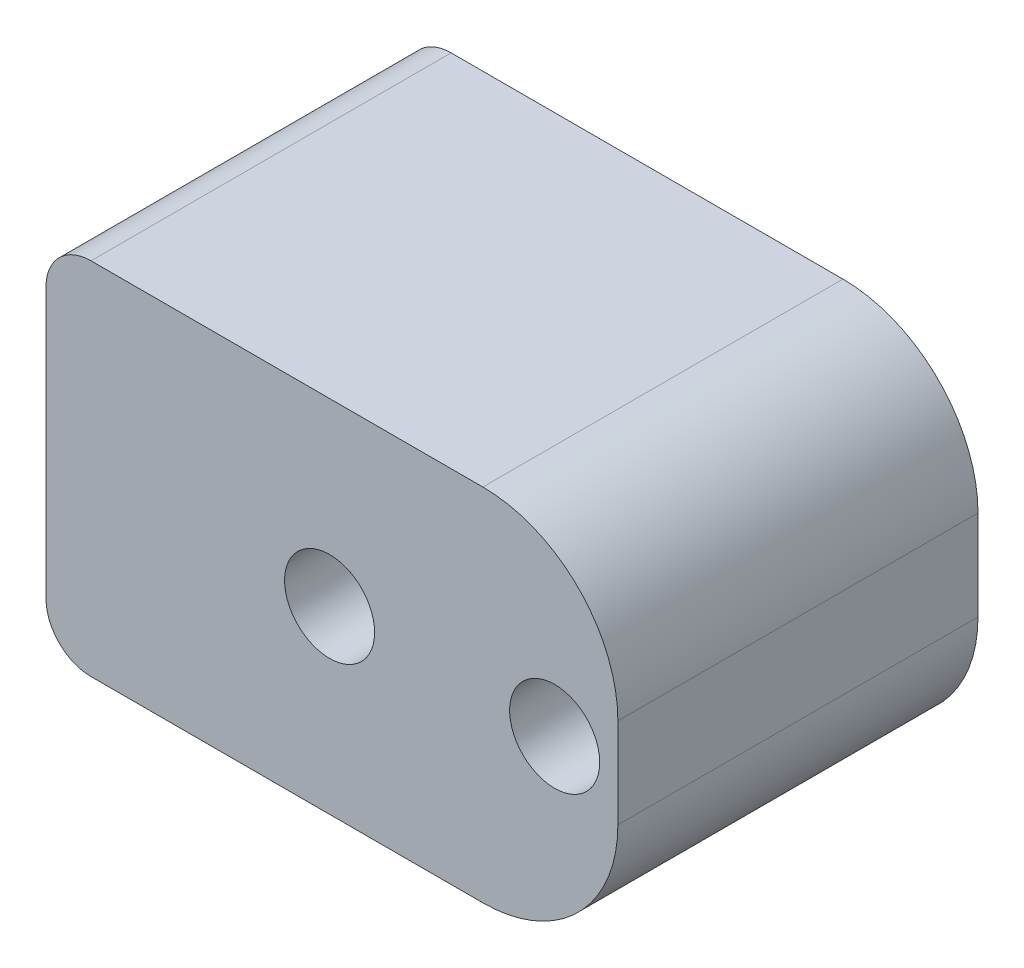
from build123d import *

# Parameters (mm, degrees)
SKETCH1_W           = 12.70451268
SKETCH1_H           = 8
SKETCH1_R           = 1
BOSS_EXTRUDE1_DEPTH = 8
CUT_EXTRUDE3_START  = -0.8
SKETCH4_R           = 3.25
CUT_EXTRUDE3_DEPTH  = 2.7
FILLET2_R           = 1
FILLET3_R           = 3


with BuildPart() as part:
    # Sketch1 → Boss-Extrude1 (new body)
    with BuildSketch(Plane.XY):
        with Locations((0.05225634, 0)):
            Rectangle(SKETCH1_W, SKETCH1_H)
        Circle(SKETCH1_R, mode=Mode.SUBTRACT)
        with Locations((5, 0)):
            Circle(SKETCH1_R, mode=Mode.SUBTRACT)
    extrude(amount=BOSS_EXTRUDE1_DEPTH)

    # Sketch4 → Cut-Extrude3 (cut)
    with BuildSketch(Plane.ZY.offset(6.3).offset(CUT_EXTRUDE3_START)):
        with Locations((4, 0)):
            Circle(SKETCH4_R)
    extrude(amount=-CUT_EXTRUDE3_DEPTH, mode=Mode.SUBTRACT)

    # Fillet2
    fillet2_edges = [part.edges().sort_by_distance(p)[0] for p in [
        (-6.3, -4, 4),
        (-6.3, 4, 4),
    ]]
    fillet(fillet2_edges, radius=FILLET2_R)

    # Fillet3
    fillet3_edges = [part.edges().sort_by_distance(p)[0] for p in [
        (6.40451268, 4, 4),
        (6.40451268, -4, 4),
    ]]
    fillet(fillet3_edges, radius=FILLET3_R)


solid = part.part
